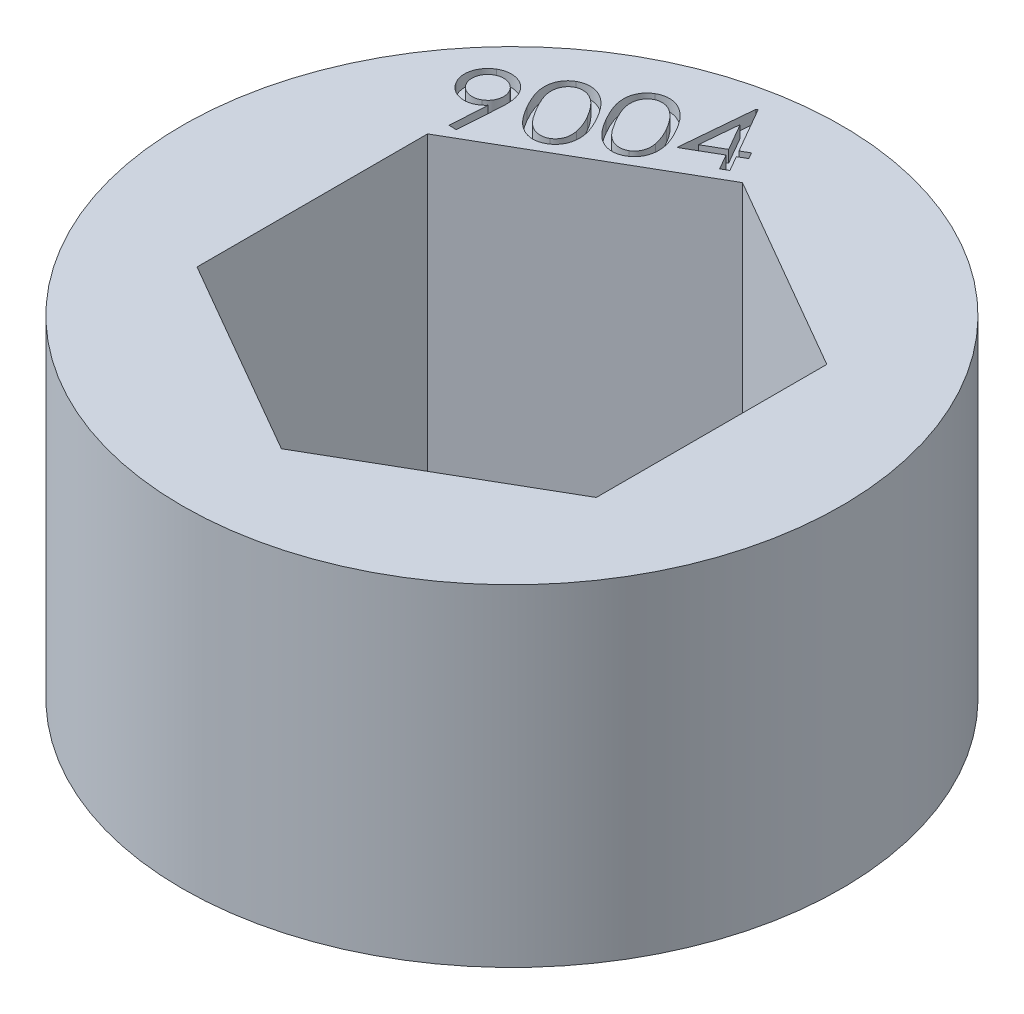
from build123d import *

# Parameters (mm, degrees)
SKETCH1_R           = 11.1125
BOSS_EXTRUDE1_DEPTH = 11.176
CUT_EXTRUDE1_DEPTH  = 0.399999962


with BuildPart() as part:
    # Sketch1 → Boss-Extrude1 (new body)
    with BuildSketch(Plane(origin=(0, 0, 0), x_dir=(1, 0, 0), z_dir=(0, 1, 0))):
        with Locations(Location((0, 0, 0), (0, 0, 270))):
            Circle(SKETCH1_R)
        Polygon((0, 7.772289324), (-6.731, 3.886144662), (-6.731, -3.886144662), (0, -7.772289324), (6.731, -3.886144662), (6.731, 3.886144662), align=None, mode=Mode.SUBTRACT)
    extrude(amount=BOSS_EXTRUDE1_DEPTH)

    # Sketch2 → Cut-Extrude1 (cut)
    # profile 1 of 4: a face of its own
    with BuildSketch(Plane(origin=(0, 11.176, 0), x_dir=(1, 0, 0), z_dir=(0, 1, 0))):
        with BuildLine():
            Line((-6.370366183, 4.489525709), (-6.618158651, 4.501737247))
            Line((-6.618158651, 4.501737247), (-6.54488942, 5.7447701))
            add(Edge.make_bspline(
                [(-6.54488942, 5.7447701), (-6.560875437, 5.727341148), (-6.591971781, 5.693437975), (-6.642472498, 5.648721206), (-6.693042877, 5.608904352), (-6.728854863, 5.587048167), (-6.746379805, 5.576352632)],
                knots=[0, 0, 0, 0, 1.07557127, 2.092224476, 3.066411598, 4, 4, 4, 4], degree=3))
            add(Edge.make_bspline(
                [(-6.746379805, 5.576352632), (-6.768038338, 5.564534049), (-6.810890701, 5.541150463), (-6.878187214, 5.514435218), (-6.946316922, 5.494648932), (-7.015496646, 5.48326444), (-7.085337911, 5.477805441), (-7.156318685, 5.480534193), (-7.22802591, 5.49089357), (-7.299879133, 5.50816758), (-7.370143283, 5.531784152), (-7.437141645, 5.561914499), (-7.500083465, 5.598175284), (-7.55871543, 5.640672398), (-7.613550193, 5.68873902), (-7.664070073, 5.742874689), (-7.71017492, 5.803390195), (-7.737071435, 5.847135441), (-7.750778844, 5.869429555)],
                knots=[0, 0, 0, 0, 1.015135184, 2.008489705, 2.974464217, 3.930823522, 4.890110555, 5.854468119, 6.84900024, 7.868689235, 8.893387844, 9.896732215, 10.888539014, 11.878968029, 12.873598221, 13.886496971, 14.922884625, 16, 16, 16, 16], degree=3))
            add(Edge.make_bspline(
                [(-7.750778844, 5.869429555), (-7.767622318, 5.90090944), (-7.800761466, 5.96284539), (-7.834316294, 6.061450232), (-7.856173536, 6.161141418), (-7.862183659, 6.262241035), (-7.856147879, 6.363132588), (-7.834679746, 6.462165438), (-7.800217602, 6.55882919), (-7.75254028, 6.651794509), (-7.693206769, 6.738791239), (-7.624472232, 6.817885273), (-7.545166859, 6.886621452), (-7.486043111, 6.923758114), (-7.456175478, 6.942518497)],
                knots=[0, 0, 0, 0, 1.035324533, 2.036977218, 3.013660684, 3.991039457, 4.968418229, 5.940283026, 6.923354643, 7.941094773, 8.965736768, 9.974485588, 10.976767849, 12, 12, 12, 12], degree=3))
            add(Edge.make_bspline(
                [(-7.456175478, 6.942518497), (-7.425703845, 6.958822415), (-7.365443833, 6.991064674), (-7.268770922, 7.023883697), (-7.169413054, 7.044007763), (-7.068159882, 7.050999468), (-6.966798758, 7.045216227), (-6.867891276, 7.025048162), (-6.771972634, 6.99179003), (-6.681315006, 6.944218242), (-6.59639747, 6.88655465), (-6.52003698, 6.819108651), (-6.453479121, 6.742150329), (-6.41748625, 6.684882803), (-6.399368587, 6.656056158)],
                knots=[0, 0, 0, 0, 1.019400264, 2.015942902, 3.002372847, 4.006779929, 5.005536382, 5.991966327, 6.979044859, 7.994053264, 9.007032045, 10.004279611, 10.995418019, 12, 12, 12, 12], degree=3))
            add(Edge.make_bspline(
                [(-6.399368587, 6.656056158), (-6.386873596, 6.632698572), (-6.361445591, 6.585164581), (-6.331174555, 6.508358281), (-6.306926269, 6.426056007), (-6.291204164, 6.353534223), (-6.28194701, 6.291866893), (-6.27612266, 6.241654597), (-6.273082658, 6.187970037), (-6.270131868, 6.130823907), (-6.269940395, 6.070404695), (-6.270947407, 6.006452587), (-6.273462546, 5.939100194), (-6.276307492, 5.892999353), (-6.277762017, 5.869429555)],
                knots=[0, 0, 0, 0, 1.179517641, 2.400384276, 3.669978525, 4.99951221, 5.702757638, 6.447991837, 7.250775919, 8.098000084, 8.997311831, 9.942054579, 10.947842213, 12, 12, 12, 12], degree=3))
            Line((-6.277762017, 5.869429555), (-6.370366183, 4.489525709))
        make_face()
        with BuildLine():
            add(Edge.make_bspline(
                [(-6.806928683, 5.798195581), (-6.791280215, 5.807718297), (-6.760547775, 5.826420212), (-6.718717994, 5.859496727), (-6.680602475, 5.895010928), (-6.647552724, 5.934582272), (-6.618347521, 5.976968573), (-6.593403123, 6.022519684), (-6.572218971, 6.071115563), (-6.556498049, 6.122587955), (-6.544450547, 6.175091204), (-6.538689658, 6.227820978), (-6.536751588, 6.279759339), (-6.540872943, 6.331151483), (-6.550836878, 6.381484904), (-6.564985484, 6.431381267), (-6.584970522, 6.480425962), (-6.601919959, 6.511869034), (-6.61052644, 6.527835004)],
                knots=[0, 0, 0, 0, 1.045108442, 2.052516081, 3.039037663, 4.014948609, 4.990090363, 5.974041511, 6.976128051, 8.011453109, 9.043011603, 10.047295345, 11.035574291, 12.007150616, 12.98344593, 13.961229243, 14.964765542, 16, 16, 16, 16], degree=3))
            add(Edge.make_bspline(
                [(-6.61052644, 6.527835004), (-6.619882079, 6.543309239), (-6.638372712, 6.573892762), (-6.671154882, 6.615527377), (-6.707014637, 6.653136973), (-6.746376638, 6.686226662), (-6.788814495, 6.715350313), (-6.834214595, 6.740472881), (-6.883072604, 6.76085879), (-6.934384256, 6.776848062), (-6.986963403, 6.788541576), (-7.039587386, 6.795411289), (-7.091608251, 6.796314051), (-7.142894692, 6.792213769), (-7.193622805, 6.783164958), (-7.243579314, 6.768017456), (-7.293288961, 6.74851801), (-7.324740516, 6.731051149), (-7.340674677, 6.722201991)],
                knots=[0, 0, 0, 0, 1.031712043, 2.039092063, 3.018573684, 3.994457873, 4.969572892, 5.953497063, 6.951758218, 7.98705489, 9.018585102, 10.024008046, 11.012022604, 11.983572292, 12.958061913, 13.947831088, 14.960318852, 16, 16, 16, 16], degree=3))
            add(Edge.make_bspline(
                [(-7.340674677, 6.722201991), (-7.356181225, 6.71288558), (-7.386714133, 6.694541257), (-7.427890185, 6.661222755), (-7.4660128, 6.625925984), (-7.49898931, 6.586296432), (-7.528337772, 6.544085258), (-7.552561277, 6.498232818), (-7.573898658, 6.449813087), (-7.589567759, 6.398312404), (-7.601629572, 6.34581674), (-7.607366873, 6.293253829), (-7.609323084, 6.241486695), (-7.605200929, 6.190263643), (-7.595240858, 6.139930316), (-7.581091209, 6.090033928), (-7.561106455, 6.040989239), (-7.544156979, 6.009546166), (-7.535550478, 5.993580196)],
                knots=[0, 0, 0, 0, 1.034021631, 2.036022986, 3.024725885, 4.002794686, 4.980092595, 5.961574923, 6.965877195, 8.00349148, 9.037330872, 10.043835206, 11.024597356, 11.998321951, 12.97677597, 13.956721278, 14.962476515, 16, 16, 16, 16], degree=3))
            add(Edge.make_bspline(
                [(-7.535550478, 5.993580196), (-7.526195245, 5.978105344), (-7.507705413, 5.947520601), (-7.474917392, 5.905894886), (-7.439079144, 5.868252578), (-7.399744778, 5.835373605), (-7.3577297, 5.805863531), (-7.312228277, 5.781095929), (-7.263652528, 5.759881485), (-7.212174539, 5.744168984), (-7.159672793, 5.732119221), (-7.106942628, 5.72635892), (-7.055004369, 5.724420697), (-7.003612198, 5.728542092), (-6.953278784, 5.738506017), (-6.90338242, 5.752654626), (-6.854337725, 5.772639662), (-6.822894653, 5.7895891), (-6.806928683, 5.798195581)],
                knots=[0, 0, 0, 0, 1.033571637, 2.042767394, 3.024014467, 4.001657624, 4.970548117, 5.956245748, 6.96011096, 7.997273687, 9.030663166, 10.03672948, 11.026762591, 12.000063433, 12.97809164, 13.957610489, 14.962928033, 16, 16, 16, 16], degree=3))
        make_face(mode=Mode.SUBTRACT)
    # profile 2 of 4: a face of its own
    with BuildSketch(Plane(origin=(0, 11.176, 0), x_dir=(1, 0, 0), z_dir=(0, 1, 0))):
        with BuildLine():
            add(Edge.make_bspline(
                [(-5.834820234, 6.337538529), (-5.854926381, 6.372842901), (-5.894029898, 6.441504746), (-5.946666919, 6.543912249), (-5.993785046, 6.641443539), (-6.034082864, 6.734610973), (-6.067928294, 6.823167546), (-6.094897764, 6.907296321), (-6.116271151, 6.986826872), (-6.130521381, 7.062560532), (-6.139252705, 7.134994975), (-6.143234594, 7.204667702), (-6.143489107, 7.272138341), (-6.138904124, 7.337441195), (-6.129838834, 7.400563188), (-6.116065725, 7.461482756), (-6.097608995, 7.520094194), (-6.075253258, 7.576586933), (-6.049085546, 7.630585743), (-6.01798219, 7.680947814), (-5.984811002, 7.729055292), (-5.947253904, 7.773254838), (-5.90700594, 7.815014715), (-5.8625423, 7.852837719), (-5.815186685, 7.888430953), (-5.781241135, 7.909034582), (-5.764095074, 7.919441574)],
                knots=[0, 0, 0, 0, 1.642217524, 3.193873097, 4.653599743, 6.020219012, 7.296149585, 8.484364078, 9.590266645, 10.622995624, 11.596731579, 12.537641419, 13.442669779, 14.322439731, 15.181528583, 16.018162769, 16.844365298, 17.663022962, 18.472528165, 19.266229043, 20.053716379, 20.832379209, 21.608138827, 22.395685855, 23.18965321, 24, 24, 24, 24], degree=3))
            add(Edge.make_bspline(
                [(-5.764095074, 7.919441574), (-5.746267435, 7.9292433), (-5.710924383, 7.948675089), (-5.655580531, 7.972306948), (-5.599838905, 7.992471208), (-5.54275374, 8.007252494), (-5.484895473, 8.017376131), (-5.425864623, 8.023029046), (-5.36598104, 8.024005455), (-5.30527706, 8.020344084), (-5.243945329, 8.012402448), (-5.182532051, 7.998565196), (-5.121310197, 7.979379752), (-5.059738667, 7.956250898), (-4.999057203, 7.9263525), (-4.938106109, 7.891997997), (-4.876976614, 7.853006925), (-4.816401598, 7.807799267), (-4.755136548, 7.757172028), (-4.694515849, 7.699155158), (-4.633627392, 7.634169576), (-4.573384601, 7.561971263), (-4.513329574, 7.482589989), (-4.452555481, 7.396723138), (-4.392842691, 7.303014685), (-4.354150494, 7.237575297), (-4.334327446, 7.204048946)],
                knots=[0, 0, 0, 0, 0.815881076, 1.617473213, 2.411751612, 3.192532544, 3.980223438, 4.766442947, 5.569622482, 6.380892254, 7.204795063, 8.048528362, 8.903143009, 9.777765604, 10.684831081, 11.614241792, 12.584586996, 13.591843045, 14.645331516, 15.771781295, 16.956234458, 18.217113798, 19.542884518, 20.949560407, 22.437178076, 24, 24, 24, 24], degree=3))
            add(Edge.make_bspline(
                [(-4.334327446, 7.204048946), (-4.315323598, 7.170226717), (-4.278260494, 7.104263405), (-4.227027713, 7.006156245), (-4.183021288, 6.91105328), (-4.144390345, 6.81973517), (-4.112446042, 6.731891879), (-4.086098952, 6.647586521), (-4.06618935, 6.566708656), (-4.052186446, 6.489026813), (-4.044396134, 6.414182607), (-4.03976422, 6.342174557), (-4.041193423, 6.272495558), (-4.045772631, 6.205099903), (-4.056284472, 6.140051897), (-4.070299764, 6.077209386), (-4.089167455, 6.016944998), (-4.112734665, 5.95937939), (-4.139976653, 5.904515054), (-4.171467792, 5.852975648), (-4.205277799, 5.803970776), (-4.243045829, 5.758302488), (-4.285240409, 5.716786215), (-4.329780522, 5.677478732), (-4.377987036, 5.641353798), (-4.412496358, 5.620501561), (-4.429984497, 5.609934363)],
                knots=[0, 0, 0, 0, 1.558572261, 3.039675171, 4.44500239, 5.767404933, 7.021920233, 8.19867626, 9.314183841, 10.366093107, 11.366862767, 12.335955634, 13.262731656, 14.164729598, 15.047477431, 15.907015182, 16.749641984, 17.580952634, 18.403702246, 19.207672054, 20.005351578, 20.794016824, 21.584181799, 22.380929523, 23.179510693, 24, 24, 24, 24], degree=3))
            add(Edge.make_bspline(
                [(-4.429984497, 5.609934363), (-4.447500761, 5.600369966), (-4.482280894, 5.581378989), (-4.536217511, 5.557264897), (-4.591553521, 5.538685498), (-4.647358228, 5.52353514), (-4.704315863, 5.514176404), (-4.761931944, 5.508338341), (-4.820629551, 5.507482188), (-4.880046928, 5.510821942), (-4.939688015, 5.519815737), (-4.999432337, 5.532654146), (-5.058555102, 5.552049636), (-5.117842697, 5.575346987), (-5.176937412, 5.604076114), (-5.23599376, 5.637610622), (-5.29458831, 5.676655722), (-5.353625463, 5.720468791), (-5.412278827, 5.771315681), (-5.471600203, 5.829214702), (-5.531452025, 5.894742035), (-5.591388699, 5.968379054), (-5.652108139, 6.049438969), (-5.712714601, 6.138535197), (-5.774711688, 6.2348407), (-5.814380166, 6.302615864), (-5.834820234, 6.337538529)],
                knots=[0, 0, 0, 0, 0.807491903, 1.603348545, 2.386916451, 3.167713854, 3.940658363, 4.719915701, 5.50935356, 6.313835313, 7.125313705, 7.947948844, 8.783651521, 9.640150085, 10.524255013, 11.440287308, 12.386399569, 13.372019105, 14.413529699, 15.525036669, 16.724996316, 18.002813491, 19.365932914, 20.822335035, 22.362637201, 24, 24, 24, 24], degree=3))
        make_face()
        with BuildLine():
            add(Edge.make_bspline(
                [(-5.62468001, 6.453039331), (-5.607219376, 6.423081929), (-5.573407958, 6.365071309), (-5.521355627, 6.282513421), (-5.470472707, 6.206775501), (-5.421362219, 6.137390558), (-5.373104469, 6.075138519), (-5.325651993, 6.020171377), (-5.279949765, 5.971453672), (-5.234857701, 5.929350543), (-5.190028918, 5.892804695), (-5.145220257, 5.860590657), (-5.099942023, 5.83264145), (-5.054599787, 5.808558588), (-5.008827212, 5.788567996), (-4.962865983, 5.772086491), (-4.916244587, 5.760605979), (-4.855186536, 5.749670492), (-4.780208574, 5.745483479), (-4.693570578, 5.754138868), (-4.611581107, 5.775525202), (-4.562067046, 5.80082674), (-4.537344273, 5.813460004)],
                knots=[0, 0, 0, 0, 1.475228016, 2.856686104, 4.15161897, 5.357081144, 6.47289893, 7.501387829, 8.445726694, 9.313720896, 10.124066195, 10.905058304, 11.660046733, 12.386348828, 13.08755313, 13.783651734, 14.460982071, 15.127735434, 16.421461315, 17.639985157, 18.821625413, 20, 20, 20, 20], degree=3))
            add(Edge.make_bspline(
                [(-4.537344273, 5.813460004), (-4.513842991, 5.828614225), (-4.467106377, 5.858751176), (-4.407271411, 5.918481615), (-4.357265312, 5.988381514), (-4.323832861, 6.054160137), (-4.303207226, 6.111268847), (-4.290175125, 6.156558345), (-4.281821314, 6.204145409), (-4.276507267, 6.253453397), (-4.275953204, 6.304653402), (-4.277688394, 6.3576957), (-4.283934223, 6.412591571), (-4.290691954, 6.449513345), (-4.294131131, 6.468303754)],
                knots=[0, 0, 0, 0, 1.342886321, 2.670576022, 4.038999414, 5.466462105, 6.205051725, 6.959707281, 7.731476591, 8.527516338, 9.344012544, 10.193626534, 11.080691652, 12, 12, 12, 12], degree=3))
            add(Edge.make_bspline(
                [(-4.294131131, 6.468303754), (-4.298934409, 6.492115195), (-4.308710199, 6.540577025), (-4.329034524, 6.613280001), (-4.352923928, 6.687869387), (-4.381307982, 6.763757477), (-4.414304124, 6.840979102), (-4.450806398, 6.919873896), (-4.49202567, 7.000349519), (-4.522384533, 7.053721603), (-4.537853087, 7.080915933)],
                knots=[0, 0, 0, 0, 0.879876913, 1.790754508, 2.73331625, 3.717259664, 4.725112015, 5.77538776, 6.866507818, 8, 8, 8, 8], degree=3))
            add(Edge.make_bspline(
                [(-4.537853087, 7.080915933), (-4.553586566, 7.107841784), (-4.584370492, 7.160524561), (-4.632964352, 7.235504172), (-4.680605876, 7.306128548), (-4.72892667, 7.371375811), (-4.77782864, 7.431171418), (-4.826078406, 7.486602349), (-4.874957042, 7.536417454), (-4.923914488, 7.581383338), (-4.97275754, 7.62150778), (-5.020924739, 7.657379328), (-5.069214174, 7.688012559), (-5.116949243, 7.714742042), (-5.164675954, 7.736470401), (-5.211860095, 7.754137691), (-5.258863542, 7.766984072), (-5.320119975, 7.777426799), (-5.394652118, 7.781725161), (-5.48071692, 7.773876512), (-5.56191377, 7.752290067), (-5.610968329, 7.727317936), (-5.635365106, 7.714898305)],
                knots=[0, 0, 0, 0, 1.327522451, 2.597413504, 3.803087542, 4.954092809, 6.052504639, 7.091116491, 8.08170511, 9.022070092, 9.919800897, 10.771882377, 11.577119672, 12.352806521, 13.099205072, 13.807429758, 14.495830891, 15.170113202, 16.450227669, 17.661618134, 18.837030004, 20, 20, 20, 20], degree=3))
            add(Edge.make_bspline(
                [(-5.635365106, 7.714898305), (-5.658901025, 7.699775614), (-5.705807029, 7.669636788), (-5.765351495, 7.60914832), (-5.816385031, 7.538854105), (-5.84939624, 7.471809288), (-5.87135729, 7.414239012), (-5.883143994, 7.368223252), (-5.892528114, 7.320702073), (-5.898237875, 7.271187398), (-5.899289549, 7.219823662), (-5.89818824, 7.166763594), (-5.892005603, 7.112131457), (-5.883658916, 7.055103043), (-5.87013097, 6.99489442), (-5.851109303, 6.930710551), (-5.826385806, 6.862099968), (-5.796885538, 6.788689418), (-5.761639578, 6.711081227), (-5.721154493, 6.628842249), (-5.675620213, 6.541983993), (-5.642005425, 6.483290548), (-5.62468001, 6.453039331)],
                knots=[0, 0, 0, 0, 1.186584607, 2.364808541, 3.584028067, 4.867913378, 5.52979883, 6.201670858, 6.884946004, 7.589109066, 8.317961587, 9.068444384, 9.84432244, 10.65432116, 11.518850237, 12.466086659, 13.499587148, 14.619373863, 15.830028341, 17.123623296, 18.517485242, 20, 20, 20, 20], degree=3))
        make_face(mode=Mode.SUBTRACT)
    # profile 3 of 4: a face of its own
    with BuildSketch(Plane(origin=(0, 11.176, 0), x_dir=(1, 0, 0), z_dir=(0, 1, 0))):
        with BuildLine():
            add(Edge.make_bspline(
                [(-4.14273983, 7.314461606), (-4.162845976, 7.349765978), (-4.201949494, 7.418427823), (-4.254586515, 7.520835326), (-4.301704642, 7.618366616), (-4.34200246, 7.71153405), (-4.375847889, 7.800090623), (-4.402817359, 7.884219398), (-4.424190746, 7.963749949), (-4.438440977, 8.039483609), (-4.4471723, 8.111918052), (-4.451154189, 8.181590779), (-4.451408703, 8.249061418), (-4.44682372, 8.314364272), (-4.43775843, 8.377486265), (-4.42398532, 8.438405833), (-4.40552859, 8.497017271), (-4.383172853, 8.55351001), (-4.357005142, 8.60750882), (-4.325901786, 8.657870891), (-4.292730598, 8.705978368), (-4.255173499, 8.750177915), (-4.214925535, 8.791937792), (-4.170461896, 8.829760795), (-4.123106281, 8.86535403), (-4.08916073, 8.885957659), (-4.072014669, 8.896364651)],
                knots=[0, 0, 0, 0, 1.642217524, 3.193873097, 4.653599743, 6.020219012, 7.296149585, 8.484364078, 9.590266645, 10.622995624, 11.596731579, 12.537641419, 13.442669779, 14.322439731, 15.181528583, 16.018162769, 16.844365298, 17.663022962, 18.472528165, 19.266229043, 20.053716379, 20.832379209, 21.608138827, 22.395685855, 23.18965321, 24, 24, 24, 24], degree=3))
            add(Edge.make_bspline(
                [(-4.072014669, 8.896364651), (-4.054187031, 8.906166377), (-4.018843979, 8.925598166), (-3.963500127, 8.949230025), (-3.907758501, 8.969394285), (-3.850673335, 8.984175571), (-3.792815069, 8.994299208), (-3.733784219, 8.999952123), (-3.673900636, 9.000928532), (-3.613196655, 8.997267161), (-3.551864925, 8.989325525), (-3.490451647, 8.975488273), (-3.429229792, 8.956302829), (-3.367658263, 8.933173975), (-3.306976799, 8.903275577), (-3.246025705, 8.868921074), (-3.18489621, 8.829930002), (-3.124321193, 8.784722343), (-3.063056144, 8.734095105), (-3.002435445, 8.676078235), (-2.941546988, 8.611092652), (-2.881304196, 8.53889434), (-2.82124917, 8.459513066), (-2.760475077, 8.373646215), (-2.700762287, 8.279937762), (-2.66207009, 8.214498374), (-2.642247041, 8.180972023)],
                knots=[0, 0, 0, 0, 0.815881076, 1.617473213, 2.411751612, 3.192532544, 3.980223438, 4.766442947, 5.569622482, 6.380892254, 7.204795063, 8.048528362, 8.903143009, 9.777765604, 10.684831081, 11.614241792, 12.584586996, 13.591843045, 14.645331516, 15.771781295, 16.956234458, 18.217113798, 19.542884518, 20.949560407, 22.437178076, 24, 24, 24, 24], degree=3))
            add(Edge.make_bspline(
                [(-2.642247041, 8.180972023), (-2.623243193, 8.147149794), (-2.58618009, 8.081186482), (-2.534947309, 7.983079322), (-2.490940884, 7.887976357), (-2.452309941, 7.796658247), (-2.420365638, 7.708814956), (-2.394018547, 7.624509598), (-2.374108945, 7.543631733), (-2.360106042, 7.46594989), (-2.352315729, 7.391105684), (-2.347683816, 7.319097634), (-2.349113019, 7.249418635), (-2.353692227, 7.18202298), (-2.364204067, 7.116974974), (-2.37821936, 7.054132463), (-2.397087051, 6.993868075), (-2.420654261, 6.936302467), (-2.447896249, 6.881438131), (-2.479387388, 6.829898725), (-2.513197394, 6.780893853), (-2.550965425, 6.735225565), (-2.593160005, 6.693709292), (-2.637700117, 6.654401809), (-2.685906631, 6.618276875), (-2.720415953, 6.597424637), (-2.737904093, 6.58685744)],
                knots=[0, 0, 0, 0, 1.558572261, 3.039675171, 4.44500239, 5.767404933, 7.021920233, 8.19867626, 9.314183841, 10.366093107, 11.366862767, 12.335955634, 13.262731656, 14.164729598, 15.047477431, 15.907015182, 16.749641984, 17.580952634, 18.403702246, 19.207672054, 20.005351578, 20.794016824, 21.584181799, 22.380929523, 23.179510693, 24, 24, 24, 24], degree=3))
            add(Edge.make_bspline(
                [(-2.737904093, 6.58685744), (-2.755420356, 6.577293043), (-2.790200489, 6.558302066), (-2.844137107, 6.534187974), (-2.899473116, 6.515608575), (-2.955277823, 6.500458217), (-3.012235458, 6.491099481), (-3.069851539, 6.485261418), (-3.128549147, 6.484405265), (-3.187966523, 6.487745018), (-3.247607611, 6.496738814), (-3.307351932, 6.509577223), (-3.366474698, 6.528972713), (-3.425762292, 6.552270063), (-3.484857008, 6.580999191), (-3.543913356, 6.614533699), (-3.602507906, 6.653578799), (-3.661545059, 6.697391867), (-3.720198423, 6.748238758), (-3.779519798, 6.806137779), (-3.83937162, 6.871665112), (-3.899308294, 6.945302131), (-3.960027735, 7.026362046), (-4.020634196, 7.115458274), (-4.082631283, 7.211763777), (-4.122299761, 7.279538941), (-4.14273983, 7.314461606)],
                knots=[0, 0, 0, 0, 0.807491903, 1.603348545, 2.386916451, 3.167713854, 3.940658363, 4.719915701, 5.50935356, 6.313835313, 7.125313705, 7.947948844, 8.783651521, 9.640150085, 10.524255013, 11.440287308, 12.386399569, 13.372019105, 14.413529699, 15.525036669, 16.724996316, 18.002813491, 19.365932914, 20.822335035, 22.362637201, 24, 24, 24, 24], degree=3))
        make_face()
        with BuildLine():
            add(Edge.make_bspline(
                [(-3.932599605, 7.429962408), (-3.915138971, 7.400005006), (-3.881327553, 7.341994386), (-3.829275223, 7.259436498), (-3.778392303, 7.183698578), (-3.729281814, 7.114313634), (-3.681024065, 7.052061596), (-3.633571588, 6.997094454), (-3.587869361, 6.948376749), (-3.542777297, 6.90627362), (-3.497948514, 6.869727772), (-3.453139853, 6.837513734), (-3.407861619, 6.809564527), (-3.362519383, 6.785481664), (-3.316746808, 6.765491073), (-3.270785579, 6.749009568), (-3.224164183, 6.737529056), (-3.163106131, 6.726593569), (-3.08812817, 6.722406556), (-3.001490173, 6.731061945), (-2.919500703, 6.752448279), (-2.869986641, 6.777749817), (-2.845263868, 6.790383081)],
                knots=[0, 0, 0, 0, 1.475228016, 2.856686104, 4.15161897, 5.357081144, 6.47289893, 7.501387829, 8.445726694, 9.313720896, 10.124066195, 10.905058304, 11.660046733, 12.386348828, 13.08755313, 13.783651734, 14.460982071, 15.127735434, 16.421461315, 17.639985157, 18.821625413, 20, 20, 20, 20], degree=3))
            add(Edge.make_bspline(
                [(-2.845263868, 6.790383081), (-2.821762587, 6.805537302), (-2.775025973, 6.835674253), (-2.715191007, 6.895404691), (-2.665184908, 6.965304591), (-2.631752456, 7.031083214), (-2.611126822, 7.088191924), (-2.59809472, 7.133481422), (-2.58974091, 7.181068486), (-2.584426863, 7.230376474), (-2.583872799, 7.281576479), (-2.585607989, 7.334618777), (-2.591853818, 7.389514648), (-2.59861155, 7.426436422), (-2.602050727, 7.445226831)],
                knots=[0, 0, 0, 0, 1.342886321, 2.670576022, 4.038999414, 5.466462105, 6.205051725, 6.959707281, 7.731476591, 8.527516338, 9.344012544, 10.193626534, 11.080691652, 12, 12, 12, 12], degree=3))
            add(Edge.make_bspline(
                [(-2.602050727, 7.445226831), (-2.606854005, 7.469038272), (-2.616629794, 7.517500102), (-2.636954119, 7.590203078), (-2.660843523, 7.664792464), (-2.689227578, 7.740680554), (-2.72222372, 7.817902179), (-2.758725993, 7.896796973), (-2.799945266, 7.977272596), (-2.830304129, 8.03064468), (-2.845772682, 8.05783901)],
                knots=[0, 0, 0, 0, 0.879876913, 1.790754508, 2.73331625, 3.717259664, 4.725112015, 5.77538776, 6.866507818, 8, 8, 8, 8], degree=3))
            add(Edge.make_bspline(
                [(-2.845772682, 8.05783901), (-2.861506162, 8.084764861), (-2.892290087, 8.137447637), (-2.940883948, 8.212427249), (-2.988525472, 8.283051625), (-3.036846266, 8.348298888), (-3.085748235, 8.408094495), (-3.133998001, 8.463525425), (-3.182876638, 8.513340531), (-3.231834084, 8.558306415), (-3.280677136, 8.598430857), (-3.328844334, 8.634302405), (-3.37713377, 8.664935636), (-3.424868839, 8.691665119), (-3.47259555, 8.713393478), (-3.519779691, 8.731060768), (-3.566783137, 8.743907149), (-3.628039571, 8.754349876), (-3.702571713, 8.758648238), (-3.788636516, 8.750799589), (-3.869833366, 8.729213144), (-3.918887925, 8.704241013), (-3.943284702, 8.691821382)],
                knots=[0, 0, 0, 0, 1.327522451, 2.597413504, 3.803087542, 4.954092809, 6.052504639, 7.091116491, 8.08170511, 9.022070092, 9.919800897, 10.771882377, 11.577119672, 12.352806521, 13.099205072, 13.807429758, 14.495830891, 15.170113202, 16.450227669, 17.661618134, 18.837030004, 20, 20, 20, 20], degree=3))
            add(Edge.make_bspline(
                [(-3.943284702, 8.691821382), (-3.966820621, 8.676698691), (-4.013726624, 8.646559865), (-4.073271091, 8.586071397), (-4.124304627, 8.515777182), (-4.157315835, 8.448732365), (-4.179276886, 8.391162089), (-4.191063589, 8.345146329), (-4.20044771, 8.29762515), (-4.206157471, 8.248110475), (-4.207209144, 8.196746739), (-4.206107835, 8.143686671), (-4.199925198, 8.089054534), (-4.191578512, 8.03202612), (-4.178050565, 7.971817497), (-4.159028899, 7.907633628), (-4.134305401, 7.839023045), (-4.104805134, 7.765612494), (-4.069559174, 7.688004304), (-4.029074089, 7.605765325), (-3.983539809, 7.51890707), (-3.94992502, 7.460213625), (-3.932599605, 7.429962408)],
                knots=[0, 0, 0, 0, 1.186584607, 2.364808541, 3.584028067, 4.867913378, 5.52979883, 6.201670858, 6.884946004, 7.589109066, 8.317961587, 9.068444384, 9.84432244, 10.65432116, 11.518850237, 12.466086659, 13.499587148, 14.619373863, 15.830028341, 17.123623296, 18.517485242, 20, 20, 20, 20], degree=3))
        make_face(mode=Mode.SUBTRACT)
    # profile 4 of 4: a face of its own
    with BuildSketch(Plane(origin=(0, 11.176, 0), x_dir=(1, 0, 0), z_dir=(0, 1, 0))):
        Polygon((-1.911825291, 10.143976831), (-1.86704965, 10.169417536), (-0.982221925, 8.637378273), (-0.71611215, 8.791548946), (-0.593996765, 8.580899908), (-0.860106541, 8.426729234), (-0.564994361, 7.915371061), (-0.784802054, 7.78867635), (-1.079914233, 8.300034523), (-2.130615355, 7.693019299), align=None)
        Polygon((-1.202029618, 8.510683561), (-1.731196284, 9.42705776), (-1.849241156, 8.136705196), align=None, mode=Mode.SUBTRACT)
    extrude(amount=-CUT_EXTRUDE1_DEPTH, mode=Mode.SUBTRACT)


solid = part.part
